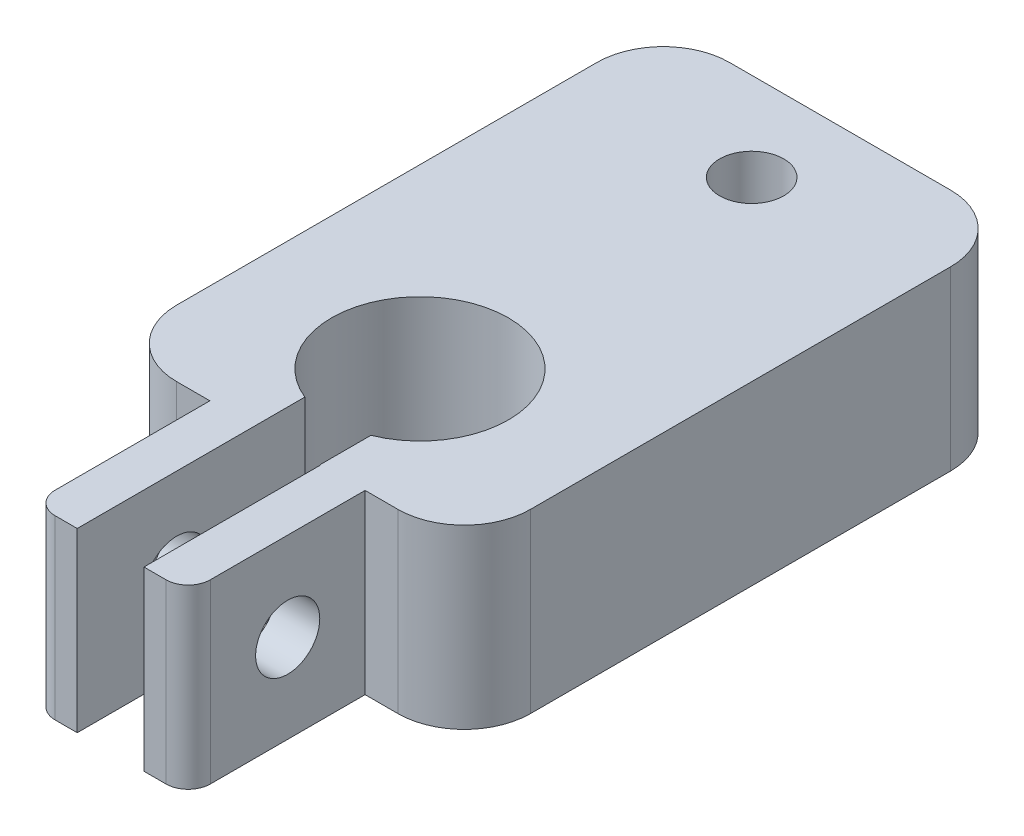
from build123d import *

# Parameters (mm, degrees)
SKETCH1_W           = 16
SKETCH1_H           = 25
SKETCH1_R           = 1.45
SKETCH1_R_2         = 4
BOSS_EXTRUDE1_DEPTH = 8
FILLET1_R           = 3
SKETCH2_W           = 2
SKETCH2_H           = 8
BOSS_EXTRUDE2_DEPTH = 8
FILLET2_R           = 1
FILLET3_R           = 1
CUT_EXTRUDE1_DEPTH  = 31.740852298
SKETCH5_R           = 1.45
CUT_EXTRUDE3_DEPTH  = 29.664809327


with BuildPart() as part:
    # Sketch1 → Boss-Extrude1 (new body)
    with BuildSketch(Plane(origin=(0, 0, 0), x_dir=(1, 0, 0), z_dir=(0, 1, 0))):
        with Locations((8, 12.5)):
            Rectangle(SKETCH1_W, SKETCH1_H)
        with Locations(Location((8, 21, 0), (0, 0, 270))):
            Circle(SKETCH1_R, mode=Mode.SUBTRACT)
        with Locations(Location((8, 6, 0), (0, 0, 270))):
            Circle(SKETCH1_R_2, mode=Mode.SUBTRACT)
    extrude(amount=BOSS_EXTRUDE1_DEPTH)

    # Fillet1
    fillet1_edges = [part.edges().sort_by_distance(p)[0] for p in [
        (0, 4, -25),
        (16, 4, -25),
        (16, 4, 0),
        (0, 4, 0),
    ]]
    fillet(fillet1_edges, radius=FILLET1_R)

    # Sketch2 → Boss-Extrude2 (add, through all)
    with BuildSketch(Plane(origin=(0, 8, 0), x_dir=(1, 0, 0), z_dir=(0, 1, 0))):
        with Locations((5.5, -4)):
            Rectangle(SKETCH2_W, SKETCH2_H)
        with Locations((10.518302555, -4)):
            Rectangle(SKETCH2_W, SKETCH2_H)
    extrude(amount=-BOSS_EXTRUDE2_DEPTH)

    # Fillet2
    fillet2_edges = [part.edges().sort_by_distance(p)[0] for p in [
        (4.5, 4, 8),
    ]]
    fillet(fillet2_edges, radius=FILLET2_R)

    # Fillet3
    fillet3_edges = [part.edges().sort_by_distance(p)[0] for p in [
        (11.518302555, 4, 8),
    ]]
    fillet(fillet3_edges, radius=FILLET3_R)

    # Sketch3 → Cut-Extrude1 (cut, through all)
    with BuildSketch(Plane(origin=(0, 8, 0), x_dir=(1, 0, 0), z_dir=(0, 1, 0))):
        with BuildLine():
            Line((6.5, 2.291900756), (6.5, -1.76134076))
            Line((6.5, -1.76134076), (9.493627756, -1.76134076))
            Line((9.493627756, -1.76134076), (9.493627756, 2.289329423))
            ThreePointArc((9.493627756, 2.289329423), (7.996564259, 2.000001476), (6.5, 2.291900756))
        make_face()
    extrude(amount=-CUT_EXTRUDE1_DEPTH, mode=Mode.SUBTRACT)

    # Sketch5 → Cut-Extrude3 (cut, through all)
    with BuildSketch(Plane(origin=(11.518302555, 0, 0), x_dir=(0, 0, -1), z_dir=(1, 0, 0))):
        with Locations((-3.5, 4)):
            Circle(SKETCH5_R)
    extrude(amount=-CUT_EXTRUDE3_DEPTH, mode=Mode.SUBTRACT)


solid = part.part
